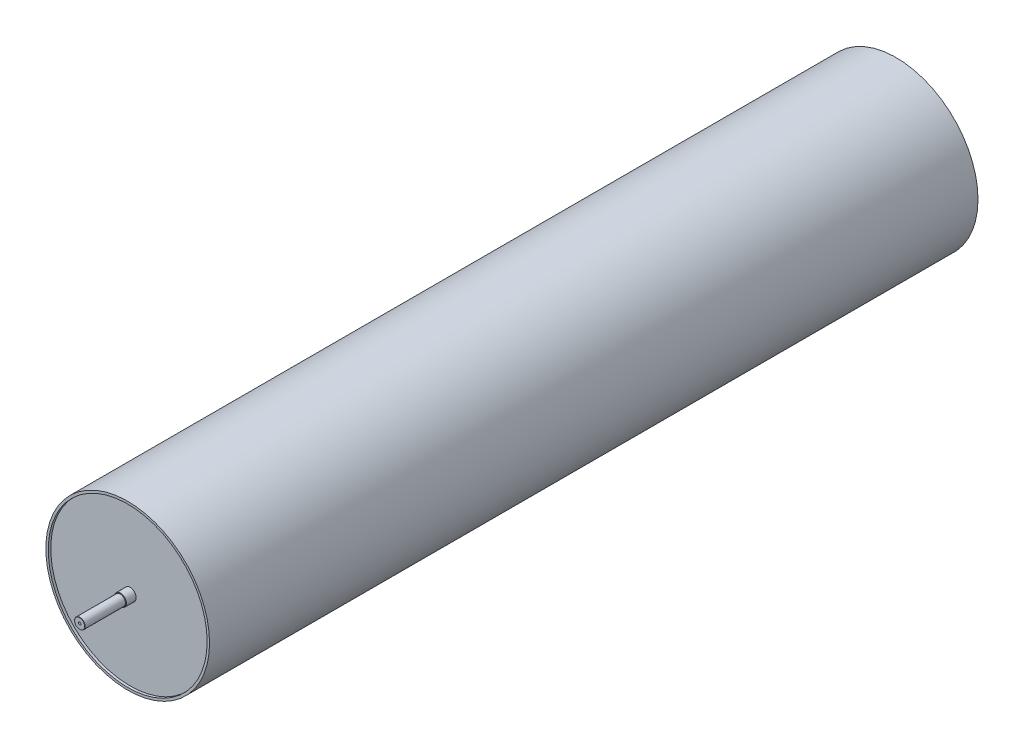
from build123d import *

# Parameters (mm, degrees)
SKETCH1_R           = 163.5
SKETCH1_R_2         = 158.7
BOSS_EXTRUDE1_DEPTH = 767.5
BOSS_EXTRUDE2_START = -10
SKETCH2_R           = 158.7
BOSS_EXTRUDE2_DEPTH = 5
CHAMFER1_SIZE       = 0.5


with BuildPart() as part:
    # Sketch1 → Boss-Extrude1 (new, symmetric)
    with BuildSketch(Plane.XY):
        Circle(SKETCH1_R)
        Circle(SKETCH1_R_2, mode=Mode.SUBTRACT)
    extrude(amount=BOSS_EXTRUDE1_DEPTH, both=True)

    # Sketch2 → Boss-Extrude2 (add)
    with BuildSketch(Plane.XY.offset(767.5).offset(BOSS_EXTRUDE2_START)):
        Circle(SKETCH2_R)
    boss_extrude2 = extrude(amount=BOSS_EXTRUDE2_DEPTH)

    # Sketch5 → Revolve1 (revolve)
    with BuildSketch(Plane(origin=(0, 0, 0), x_dir=(0, 0, -1), z_dir=(1, 0, 0)), mode=Mode.PRIVATE) as revolve1_sk:
        Polygon((-782.5, 12), (782.5, 12), (782.5, 10.5), (863.5, 10.5), (863.5, 0), (-863.5, 0), (-863.5, 10.5), (-782.5, 10.5), align=None)
    revolve(revolve1_sk.sketch.rotate(Axis((0, 0, -863.5), (0, 0, -1)), 180), axis=Axis((0, 0, -863.5), (0, 0, -1)))

    # Chamfer1
    chamfer1_edges = [part.edges().sort_by_distance(p)[0] for p in [
        (0, 12, -782.5),
        (0, 12, 782.5),
        (0, 10.5, -863.5),
        (0, 10.5, 863.5),
    ]]
    chamfer(chamfer1_edges, length=CHAMFER1_SIZE)

    # Sketch7 → M6 Tapped Hole1 (revolve, cut)
    with BuildSketch(Plane(origin=(0, 0, 863.5), x_dir=(0, -1, 0), z_dir=(1, 0, 0))):
        Polygon((0, 0), (0, 16.502151548), (2.5, 15), (2.5, 0), align=None)
    m6_tapped_hole1 = revolve(axis=Axis((0, 0, 869.85), (0, 0, -1)), mode=Mode.SUBTRACT)

    # Mirror3: Boss-Extrude2, M6 Tapped Hole1 across plane
    add(boss_extrude2.mirror(Plane.XY))
    add(m6_tapped_hole1.mirror(Plane.XY), mode=Mode.SUBTRACT)


solid = part.part
